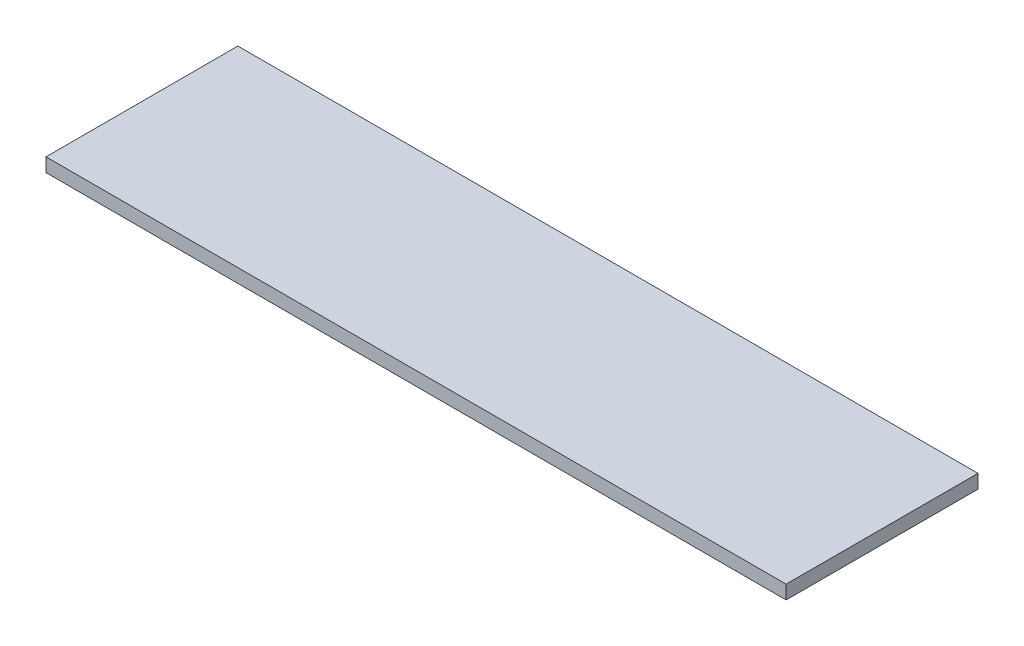
from build123d import *

# Parameters (mm, degrees)
SKETCH1_W           = 162
SKETCH1_H           = 42
BOSS_EXTRUDE1_DEPTH = 3


with BuildPart() as part:
    # Sketch1 → Boss-Extrude1 (new body)
    with BuildSketch(Plane(origin=(0, 0, 0), x_dir=(1, 0, 0), z_dir=(0, 1, 0))):
        Rectangle(SKETCH1_W, SKETCH1_H)
    extrude(amount=BOSS_EXTRUDE1_DEPTH)


solid = part.part
